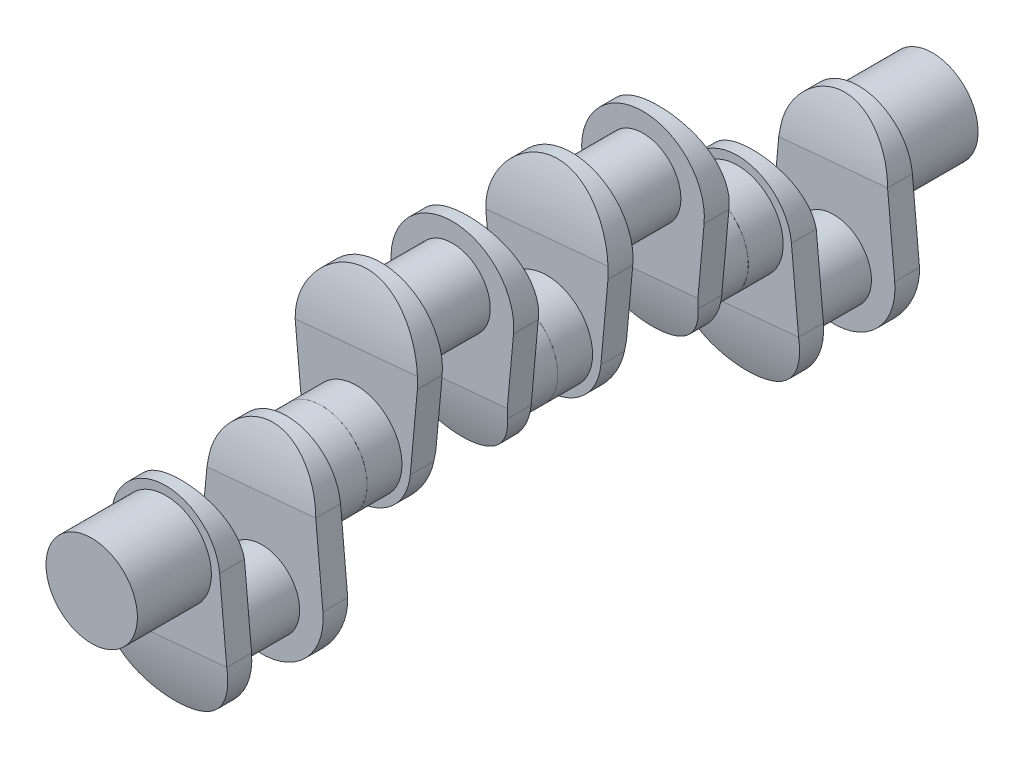
from build123d import *

# Parameters (mm, degrees)
SKETCH1_R              = 35
BOSS_EXTRUDE1_DEPTH    = 26.67
BOSS_EXTRUDE2_DEPTH    = 19
SKETCH3_R              = 29
BOSS_EXTRUDE3_DEPTH    = 27.31
CUT_EXTRUDE1_DEPTH     = 150.075596841
LPATTERN1_COUNT        = 3
LPATTERN1_PITCH        = 146
BODY_MOVE_COPY1_ANGLE  = 120
BODY_MOVE_COPY2_ANGLE  = 120
SKETCH5_R              = 35
BOSS_EXTRUDE4_DEPTH    = 30
BODY_MOVE_COPY7_ANGLE  = 60
BODY_MOVE_COPY8_ANGLE  = 60
BODY_MOVE_COPY10_ANGLE = 180
SKETCH8_R              = 35
BOSS_EXTRUDE6_DEPTH    = 30


with BuildPart() as part:
    # Sketch1 → Boss-Extrude1 (new body)
    with BuildSketch(Plane.XY):
        Circle(SKETCH1_R)
    extrude(amount=BOSS_EXTRUDE1_DEPTH)

    # Sketch1<3> → Boss-Extrude2 (add)
    with BuildSketch(Plane.XY):
        with BuildLine():
            ThreePointArc((41.325274542, 3.804166667), (0, 41.5), (-41.325274542, 3.804166667))
            Line((-41.325274542, 3.804166667), (-46.802118156, -55.691666667))
            ThreePointArc((-46.802118156, -55.691666667), (0, -107), (46.802118156, -55.691666667))
            Line((46.802118156, -55.691666667), (41.325274542, 3.804166667))
        make_face()
    extrude(amount=-BOSS_EXTRUDE2_DEPTH)

    # Sketch3 → Boss-Extrude3 (add)
    with BuildSketch(Plane(origin=(0, 0, -19), x_dir=(-1, 0, 0), z_dir=(0, 0, -1))):
        with Locations((0, -63.5)):
            Circle(SKETCH3_R)
    extrude(amount=BOSS_EXTRUDE3_DEPTH)

    # Sketch4 → Cut-Extrude1 (cut, through all)
    with BuildSketch(Plane(origin=(41.325274542, 3.804166667, 0), x_dir=(0, 0, -1), z_dir=(0.9957897480001602, 0.09166666666666667, 0))):
        with BuildLine():
            Line((9.5, 41.5), (32.858891389, 41.5))
            Line((32.858891389, 41.5), (32.858891389, 0))
            Line((32.858891389, 0), (19, 0))
            ThreePointArc((19, 0), (15.562028566, 21.050343889), (9.5, 41.5))
        make_face()
        with BuildLine():
            Line((0, -59.74738488), (-12.485918635, -59.74738488))
            Line((-12.485918635, -59.74738488), (-12.485918635, -106.74738488))
            Line((-12.485918635, -106.74738488), (9.5, -106.74738488))
            ThreePointArc((9.5, -106.74738488), (3.074609411, -83.586027659), (0, -59.74738488))
        make_face()
    extrude(amount=-CUT_EXTRUDE1_DEPTH, mode=Mode.SUBTRACT)

    # Mirror3: part across plane


with BuildPart() as part_1:
    add(part.part)
    add(part.part.mirror(Plane(origin=(0, -63.5, -46.31), x_dir=(1, 0, 0), z_dir=(0, 0, -1))))


with BuildPart() as lpattern1_1:
    # LPattern1: pattern copy
    add(part_1.part.moved(Location(Vector(0, 0, -1) * (1 * LPATTERN1_PITCH))))


with BuildPart() as lpattern1_2:
    # LPattern1: pattern copy
    add(part_1.part.moved(Location(Vector(0, 0, -1) * (2 * LPATTERN1_PITCH))))


with BuildPart() as lpattern1_1_1:
    # Body-Move/Copy1: moved
    add(lpattern1_1.part.rotate(Axis((0, 0, 0), (0, 0, -1)), BODY_MOVE_COPY1_ANGLE))


with BuildPart() as lpattern1_2_1:
    # Body-Move/Copy2: moved
    add(lpattern1_2.part.rotate(Axis((0, 0, 0), (0, 0, 1)), BODY_MOVE_COPY2_ANGLE))


with BuildPart() as part_2:
    add(part_1.part)

    # Sketch5 → Boss-Extrude4 (add)
    with BuildSketch(Plane.XY.offset(26.67)):
        Circle(SKETCH5_R)
    extrude(amount=BOSS_EXTRUDE4_DEPTH)


with BuildPart() as lpattern1_1_2:
    # Body-Move/Copy7: moved
    add(lpattern1_1_1.part.rotate(Axis((0, 0, 0), (0, 0, -1)), BODY_MOVE_COPY7_ANGLE))


with BuildPart() as lpattern1_2_2:
    # Body-Move/Copy8: moved
    add(lpattern1_2_1.part.rotate(Axis((0, 0, 0), (0, 0, 1)), BODY_MOVE_COPY8_ANGLE))


with BuildPart() as body_4:
    # Body-Move/Copy9: copy of LPattern1_2
    add(lpattern1_2_2.part.moved(Location((0, 0, -146))))


with BuildPart() as body_4_1:
    # Body-Move/Copy10: moved
    add(body_4.part.rotate(Axis((0, 0, 0), (0, 0, 1)), BODY_MOVE_COPY10_ANGLE))

    # Sketch8 → Boss-Extrude6 (add)
    with BuildSketch(Plane(origin=(0, 0, -557.29), x_dir=(-1, 0, 0), z_dir=(0, 0, -1))):
        Circle(SKETCH8_R)
    extrude(amount=BOSS_EXTRUDE6_DEPTH)


solid = Compound([part_2.part, lpattern1_1_2.part, lpattern1_2_2.part, body_4_1.part])
